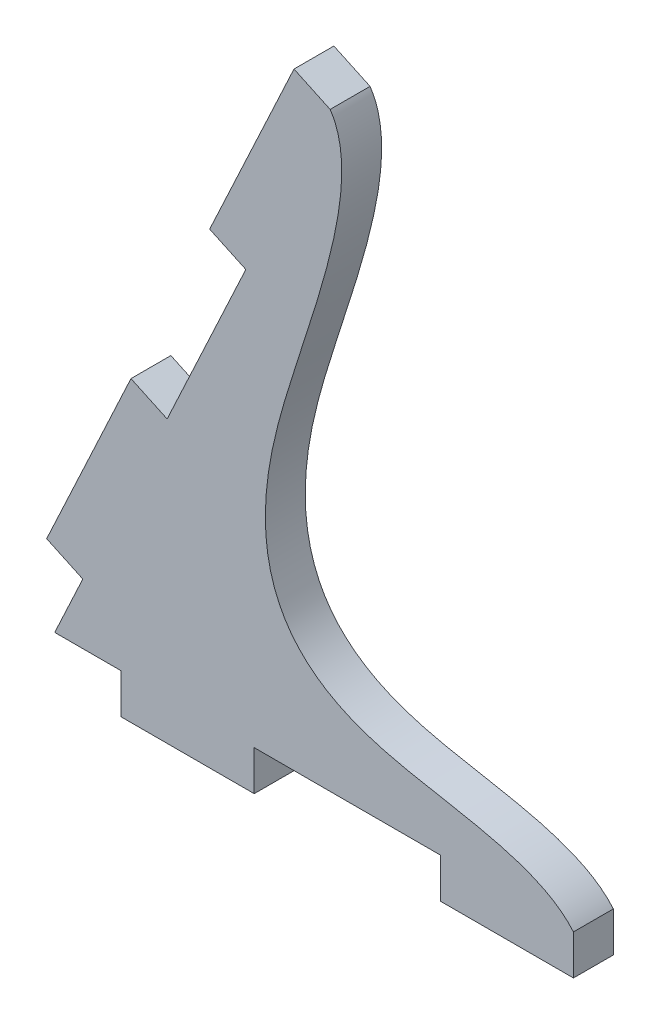
from build123d import *

# Parameters (mm, degrees)
CROQUIS1_W              = 10
CROQUIS1_H              = 3
SALIENTE_EXTRUIR1_DEPTH = 3


with BuildPart() as part:
    # Croquis1 → Saliente-Extruir1 (new body)
    with BuildSketch(Plane.XY):
        with BuildLine():
            add(Edge.make_bspline(
                [(39, 0), (36.40214132, 3.088022609), (28.216098057, 3.51534273), (17.817341549, 6.883397235), (14.464397514, 12.494859187), (18.111199106, 27.508013375), (23.361602612, 40.564262704), (20.708294825, 44.409081565)],
                knots=[0, 0, 0, 0, 0.279353688, 0.353115643, 0.694896896, 0.763857598, 1, 1, 1, 1], degree=3))
            Line((20.708294825, 44.409081565), (14.369020899, 30.814464759))
            Line((14.369020899, 30.814464759), (8.452365235, 18.126155741))
            Line((8.452365235, 18.126155741), (2.113091309, 4.531538935))
            Line((2.113091309, 4.531538935), (0, 0))
            Line((0, 0), (5, 0))
            Line((5, 0), (15, 0))
            Line((15, 0), (29, 0))
            Line((29, 0), (39, 0))
        make_face()
        Polygon((2.113091309, 4.531538935), (8.452365235, 18.126155741), (5.733441874, 19.394010526), (-0.605832052, 5.79939372), align=None)
        Polygon((14.369020899, 30.814464759), (20.708294825, 44.409081565), (17.989371464, 45.67693635), (11.650097538, 32.082319544), align=None)
        with Locations((10, -1.5)):
            Rectangle(CROQUIS1_W, CROQUIS1_H)
        with Locations((34, -1.5)):
            Rectangle(CROQUIS1_W, CROQUIS1_H)
    extrude(amount=SALIENTE_EXTRUIR1_DEPTH)


solid = part.part
